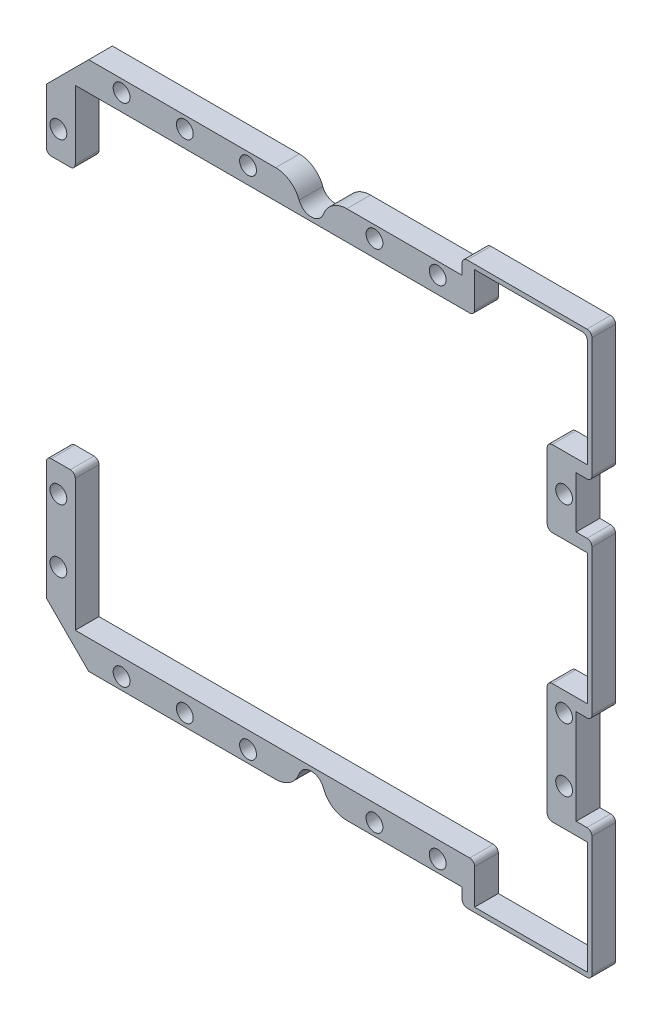
from build123d import *

# Parameters (mm, degrees)
SKETCH1_R           = 3.38
BOSS_EXTRUDE1_DEPTH = 9.525
FILLET1_R           = 10
FILLET2_R           = 2


with BuildPart() as part:
    # Sketch1 → Boss-Extrude1 (new body)
    # profile 1 of 7: a face of its own
    with BuildSketch(Plane.XY):
        Polygon((212.852, -66.426), (212.852, -71.426), (217.352, -71.426), (217.352, -123.926), (212.852, -123.926), (212.852, -128.926), (219.202, -128.926), (219.202, -66.426), align=None)
    # profile 2 of 7: a face of its own
    with BuildSketch(Plane.XY):
        Polygon((212.852, -40.7759), (201.238585453, -40.7759), (201.238585453, -71.426), (212.852, -71.426), (212.852, -66.426), (212.852, -45.7759), align=None)
        with Locations(Location((208.026, -55.626, 0), (0, 0, 180))):
            Circle(SKETCH1_R, mode=Mode.SUBTRACT)
    # profile 3 of 7: a face of its own
    with BuildSketch(Plane.XY):
        Polygon((212.852, -123.926), (201.238585453, -123.926), (201.238585453, -172.0761), (212.852, -172.0761), (212.852, -167.0761), (212.852, -128.926), align=None)
        with Locations(Location((208.026, -157.226, 0), (0, 0, 180))):
            Circle(SKETCH1_R, mode=Mode.SUBTRACT)
        with Locations(Location((208.026, -131.826, 0), (0, 0, 180))):
            Circle(SKETCH1_R, mode=Mode.SUBTRACT)
    # profile 4 of 7: a face of its own
    with BuildSketch(Plane.XY):
        Polygon((172.0761, -217.352), (172.0761, -212.852), (167.0761, -212.852), (167.0761, -219.202), (219.202, -219.202), (219.202, -167.0761), (212.852, -167.0761), (212.852, -172.0761), (217.352, -172.0761), (217.352, -217.352), align=None)
    # profile 5 of 7: a face of its own
    with BuildSketch(Plane.XY):
        Polygon((167.0761, 0), (172.0761, 0), (172.0761, 4.5), (217.352, 4.5), (217.352, -40.7759), (212.852, -40.7759), (212.852, -45.7759), (219.202, -45.7759), (219.202, 6.35), (167.0761, 6.35), align=None)
    # profile 6 of 7: a face of its own
    with BuildSketch(Plane.XY):
        with BuildLine():
            Line((11.613414547, -41.101), (11.613414547, -11.613414547))
            Line((11.613414547, -11.613414547), (172.0761, -11.613414547))
            Line((172.0761, -11.613414547), (172.0761, 0))
            Line((172.0761, 0), (167.0761, 0))
            Line((167.0761, 0), (108.347061293, 0))
            ThreePointArc((108.347061293, 0), (110.724797574, -1.910336798), (111.6203, -4.826))
            ThreePointArc((111.6203, -4.826), (103.510336798, -9.124797574), (104.504938707, 0))
            Line((104.504938707, 0), (16.997849507, 0))
            Line((16.997849507, 0), (0, -16.997849507))
            Line((0, -16.997849507), (0, -41.101))
            Line((0, -41.101), (11.613414547, -41.101))
        make_face()
        with Locations(Location((4.826, -30.226, 0), (0, 0, 180))):
            Circle(SKETCH1_R, mode=Mode.SUBTRACT)
        with Locations(Location((30.226, -4.826, 0), (0, 0, 180))):
            Circle(SKETCH1_R, mode=Mode.SUBTRACT)
        with Locations(Location((55.626, -4.826, 0), (0, 0, 180))):
            Circle(SKETCH1_R, mode=Mode.SUBTRACT)
        with Locations(Location((81.026, -4.826, 0), (0, 0, 180))):
            Circle(SKETCH1_R, mode=Mode.SUBTRACT)
        with Locations(Location((131.826, -4.826, 0), (0, 0, 180))):
            Circle(SKETCH1_R, mode=Mode.SUBTRACT)
        with Locations(Location((157.226, -4.826, 0), (0, 0, 180))):
            Circle(SKETCH1_R, mode=Mode.SUBTRACT)
    # profile 7 of 7: a face of its own
    with BuildSketch(Plane.XY):
        with BuildLine():
            Line((11.613414547, -201.238585453), (11.613414547, -146.351))
            Line((11.613414547, -146.351), (0, -146.351))
            Line((0, -146.351), (0, -195.854150493))
            Line((0, -195.854150493), (16.997849507, -212.852))
            Line((16.997849507, -212.852), (104.504938707, -212.852))
            ThreePointArc((104.504938707, -212.852), (103.510336798, -203.727202426), (111.6203, -208.026))
            ThreePointArc((111.6203, -208.026), (110.724797574, -210.941663202), (108.347061293, -212.852))
            Line((108.347061293, -212.852), (167.0761, -212.852))
            Line((167.0761, -212.852), (172.0761, -212.852))
            Line((172.0761, -212.852), (172.0761, -201.238585453))
            Line((172.0761, -201.238585453), (11.613414547, -201.238585453))
        make_face()
        with Locations(Location((30.226, -208.026, 0), (0, 0, 180))):
            Circle(SKETCH1_R, mode=Mode.SUBTRACT)
        with Locations(Location((4.826, -182.626, 0), (0, 0, 180))):
            Circle(SKETCH1_R, mode=Mode.SUBTRACT)
        with Locations(Location((55.626, -208.026, 0), (0, 0, 180))):
            Circle(SKETCH1_R, mode=Mode.SUBTRACT)
        with Locations(Location((81.026, -208.026, 0), (0, 0, 180))):
            Circle(SKETCH1_R, mode=Mode.SUBTRACT)
        with Locations(Location((4.826, -157.226, 0), (0, 0, 180))):
            Circle(SKETCH1_R, mode=Mode.SUBTRACT)
        with Locations(Location((131.826, -208.026, 0), (0, 0, 180))):
            Circle(SKETCH1_R, mode=Mode.SUBTRACT)
        with Locations(Location((157.226, -208.026, 0), (0, 0, 180))):
            Circle(SKETCH1_R, mode=Mode.SUBTRACT)
    extrude(amount=BOSS_EXTRUDE1_DEPTH)

    # Fillet1
    fillet1_edges = [part.edges().sort_by_distance(p)[0] for p in [
        (108.347061293, -212.852, 4.7625),
        (104.504938707, -212.852, 4.7625),
        (104.504938707, 0, 4.7625),
        (108.347061293, 0, 4.7625),
    ]]
    fillet(fillet1_edges, radius=FILLET1_R)

    # Fillet2
    fillet2_edges = [part.edges().sort_by_distance(p)[0] for p in [
        (219.202, -128.926, 4.7625),
        (219.202, -167.0761, 4.7625),
        (219.202, -219.202, 4.7625),
        (167.0761, -219.202, 4.7625),
        (0, -146.351, 4.7625),
        (11.613414547, -146.351, 4.7625),
        (172.0761, -201.238585453, 4.7625),
        (201.238585453, -172.0761, 4.7625),
        (201.238585453, -123.926, 4.7625),
        (201.238585453, -71.426, 4.7625),
        (201.238585453, -40.7759, 4.7625),
        (217.352, 4.5, 4.7625),
        (172.0761, -11.613414547, 4.7625),
        (11.613414547, -41.101, 4.7625),
        (0, -41.101, 4.7625),
        (167.0761, 6.35, 4.7625),
        (219.202, 6.35, 4.7625),
        (219.202, -45.7759, 4.7625),
        (219.202, -66.426, 4.7625),
    ]]
    fillet(fillet2_edges, radius=FILLET2_R)


solid = part.part
